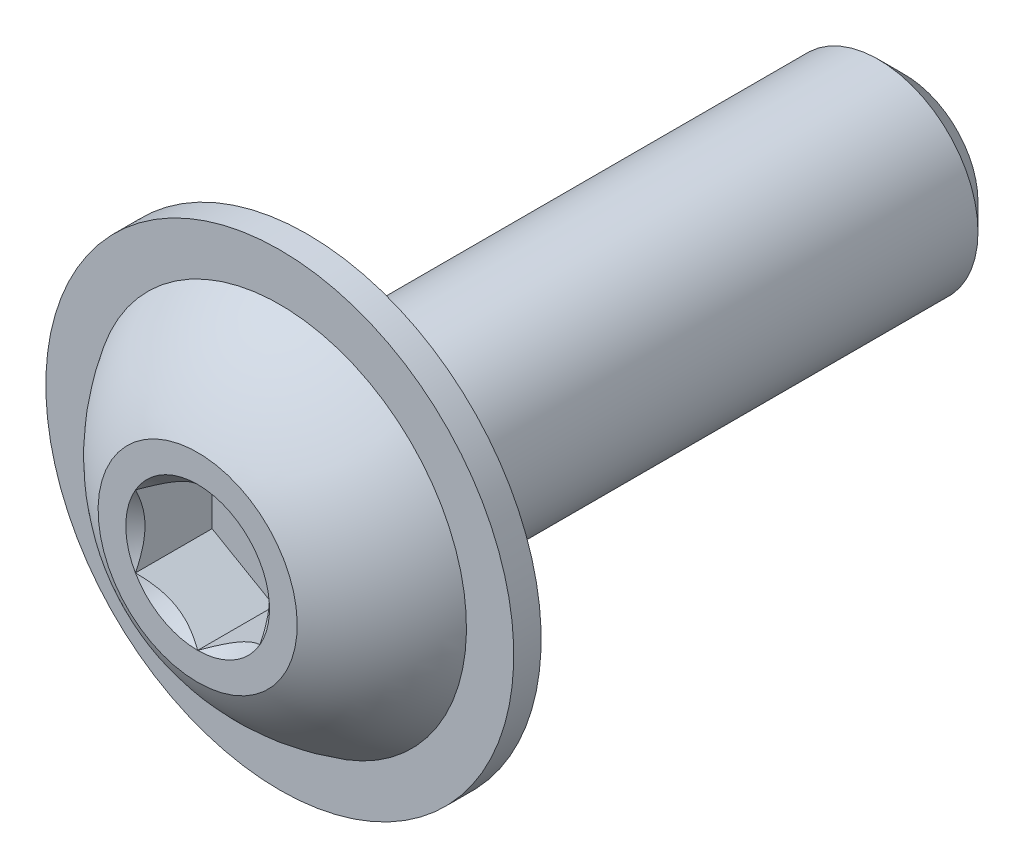
from build123d import *

# Parameters (mm, degrees)
SKETCH13_W         = 12
SKETCH13_H         = 2
CHAMFER1_SIZE      = 0.525
CUT_EXTRUDE2_DEPTH = 1.54


with BuildPart() as part:
    # Sketch13 → Revolve1 (revolve)
    with BuildSketch(Plane(origin=(0, 0, 0), x_dir=(0, 0, -1), z_dir=(1, 0, 0))):
        with Locations((1.1, 1)):
            Rectangle(SKETCH13_W, SKETCH13_H)
    revolve(axis=Axis((0, 0, 7.1), (0, 0, -1)))

    # Chamfer1
    chamfer1_edges = [part.edges().sort_by_distance(p)[0] for p in [
        (0, -2, -7.1),
    ]]
    chamfer(chamfer1_edges, length=CHAMFER1_SIZE)

    # Sketch7 → Revolve2 (revolve)
    with BuildSketch(Plane(origin=(0, 0, 0), x_dir=(0, 0, -1), z_dir=(1, 0, 0))):
        with BuildLine():
            Line((-4.9, 3.75), (-4.9, 0))
            Line((-4.9, 0), (-7.1, 0))
            Line((-7.1, 0), (-7.1, 2))
            ThreePointArc((-7.1, 2), (-6.398060267, 2.991028251), (-5.45, 3.75))
            Line((-5.45, 3.75), (-5.45, 4.7))
            Line((-5.45, 4.7), (-4.9, 4.7))
            Line((-4.9, 4.7), (-4.9, 3.75))
        make_face()
    revolve(axis=Axis((0, 0, 7.1), (0, 0, -1)))

    # Sketch5 → Cut-Extrude2 (cut)
    with BuildSketch(Plane.XY.offset(7.1)):
        Polygon((1.25, -0.721687836), (1.25, 0.721687836), (0, 1.443375673), (-1.25, 0.721687836), (-1.25, -0.721687836), (0, -1.443375673), align=None)
    extrude(amount=-CUT_EXTRUDE2_DEPTH, mode=Mode.SUBTRACT)

    # Cut-Extrude3 cone 1 section (through the dimple's axis) → Cut-Extrude3 (revolve, cut)
    with BuildSketch(Plane(origin=(0, 0, 7.1), x_dir=(0, -1, 0), z_dir=(1, 0, 0))):
        Polygon((0, 0), (1.443375673, 0), (0, 1.443375673), align=None)
    revolve(axis=Axis((0, 0, 7.1), (0, 0, -1)), mode=Mode.SUBTRACT)


solid = part.part
